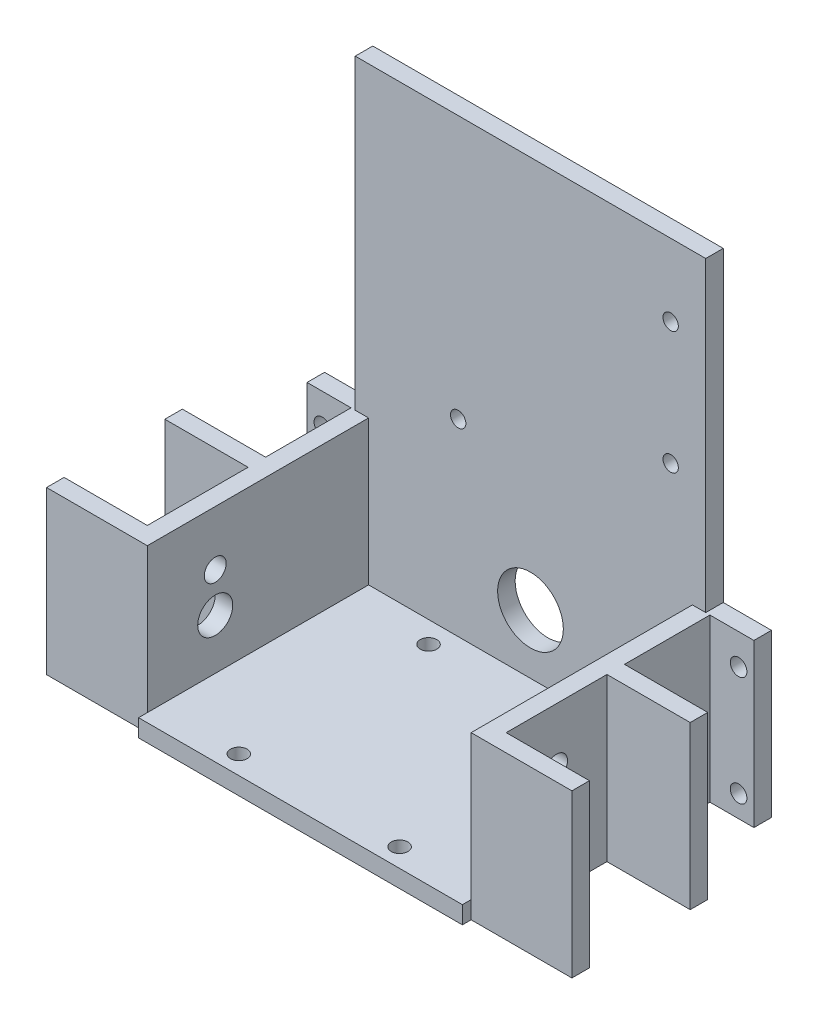
from build123d import *

# Parameters (mm, degrees)
BOSS_EXTRUDE1_DEPTH = 4
BOSS_EXTRUDE2_START = -4
BOSS_EXTRUDE2_DEPTH = 37
SKETCH3_R           = 4
SKETCH3_R_2         = 2.5
CUT_EXTRUDE1_DEPTH  = 109.592312231
SKETCH4_W           = 73.911051306
SKETCH4_H           = 52.5
BOSS_EXTRUDE3_DEPTH = 4
SKETCH5_R           = 1.9
CUT_EXTRUDE2_DEPTH  = 37
BOSS_EXTRUDE4_START = -4
BOSS_EXTRUDE4_DEPTH = 37
SKETCH7_R           = 1.9
SKETCH7_R_2         = 7.5
CUT_EXTRUDE4_DEPTH  = 4
SKETCH8_W           = 80
SKETCH8_H           = 70
SKETCH8_R           = 1.75
BOSS_EXTRUDE5_DEPTH = 4


with BuildPart() as part:
    # Sketch1 → Boss-Extrude1 (new body)
    with BuildSketch(Plane(origin=(0, 0, 0), x_dir=(1, 0, 0), z_dir=(0, 1, 0))):
        Polygon((40.955525653, 11.5), (59.955525653, 11.5), (59.955525653, 15.5), (-59.955525653, 15.5), (-59.955525653, 11.5), (-40.955525653, 11.5), (-40.955525653, -11.5), (-59.955525653, -11.5), (-59.955525653, -15.5), (59.955525653, -15.5), (59.955525653, -11.5), (40.955525653, -11.5), align=None)
    extrude(amount=BOSS_EXTRUDE1_DEPTH)

    # Sketch2 → Boss-Extrude2 (add)
    with BuildSketch(Plane(origin=(0, 4, 0), x_dir=(1, 0, 0), z_dir=(0, 1, 0)).offset(BOSS_EXTRUDE2_START)):
        Polygon((-36.955525653, 15.5), (-59.955525653, 15.5), (-59.955525653, 11.5), (-40.955525653, 11.5), (-40.955525653, -11.5), (-59.955525653, -11.5), (-59.955525653, -15.5), (-36.955525653, -15.5), align=None)
        Polygon((36.955525653, -15.5), (36.955525653, 15.5), (59.955525653, 15.5), (59.955525653, 11.5), (40.955525653, 11.5), (40.955525653, -11.5), (59.955525653, -11.5), (59.955525653, -15.5), align=None)
    extrude(amount=BOSS_EXTRUDE2_DEPTH)

    # Sketch3 → Cut-Extrude1 (cut, through all)
    with BuildSketch(Plane.ZY.offset(40.955525653)):
        with Locations((0, 15.5)):
            Circle(SKETCH3_R)
        with Locations((0, 24.5)):
            Circle(SKETCH3_R_2)
    extrude(amount=-CUT_EXTRUDE1_DEPTH, mode=Mode.SUBTRACT)

    # Sketch4 → Boss-Extrude3 (add)
    with BuildSketch(Plane(origin=(0, 4, 0), x_dir=(1, 0, 0), z_dir=(0, 1, 0))):
        with Locations((0, 8.75)):
            Rectangle(SKETCH4_W, SKETCH4_H)
    extrude(amount=-BOSS_EXTRUDE3_DEPTH)

    # Sketch5 → Cut-Extrude2 (cut)
    with BuildSketch(Plane(origin=(0, 4, 0), x_dir=(1, 0, 0), z_dir=(0, 1, 0))):
        with Locations(Location((-18.35, 30.080617362, 0), (0, 0, 270))):
            Circle(SKETCH5_R)
        with Locations(Location((18.35, 30.080617362, 0), (0, 0, 270))):
            Circle(SKETCH5_R)
        with Locations(Location((18.35, -13.219382638, 0), (0, 0, 270))):
            Circle(SKETCH5_R)
        with Locations(Location((-18.35, -13.219382638, 0), (0, 0, 270))):
            Circle(SKETCH5_R)
    extrude(amount=-CUT_EXTRUDE2_DEPTH, mode=Mode.SUBTRACT)

    # Sketch6 → Boss-Extrude4 (add)
    with BuildSketch(Plane(origin=(0, 4, 0), x_dir=(1, 0, 0), z_dir=(0, 1, 0)).offset(BOSS_EXTRUDE4_START)):
        Polygon((-36.955525653, 15.5), (-36.955525653, 35), (36.955525653, 35), (36.955525653, 15.5), (40.955525653, 15.5), (40.955525653, 35), (51, 35), (51, 39), (-51, 39), (-51, 35), (-40.955525653, 35), (-40.955525653, 15.5), align=None)
    extrude(amount=BOSS_EXTRUDE4_DEPTH)

    # Sketch7 → Cut-Extrude4 (cut)
    with BuildSketch(Plane(origin=(0, 0, -39), x_dir=(-1, 0, 0), z_dir=(0, 0, -1))):
        with Locations((-47.5, 30)):
            Circle(SKETCH7_R)
        with Locations((47.5, 30)):
            Circle(SKETCH7_R)
        with Locations((47.5, 5)):
            Circle(SKETCH7_R)
        with Locations((-47.5, 5)):
            Circle(SKETCH7_R)
        with Locations((0, 17.5)):
            Circle(SKETCH7_R_2)
    extrude(amount=-CUT_EXTRUDE4_DEPTH, mode=Mode.SUBTRACT)

    # Sketch8 → Boss-Extrude5 (add)
    with BuildSketch(Plane(origin=(0, 0, -39), x_dir=(-1, 0, 0), z_dir=(0, 0, -1))):
        with Locations((0, 72)):
            Rectangle(SKETCH8_W, SKETCH8_H)
        with Locations((-32, 90.5)):
            Circle(SKETCH8_R, mode=Mode.SUBTRACT)
        with Locations((-32, 62.5)):
            Circle(SKETCH8_R, mode=Mode.SUBTRACT)
        with Locations((16.5, 47)):
            Circle(SKETCH8_R, mode=Mode.SUBTRACT)
    extrude(amount=-BOSS_EXTRUDE5_DEPTH)


solid = part.part
